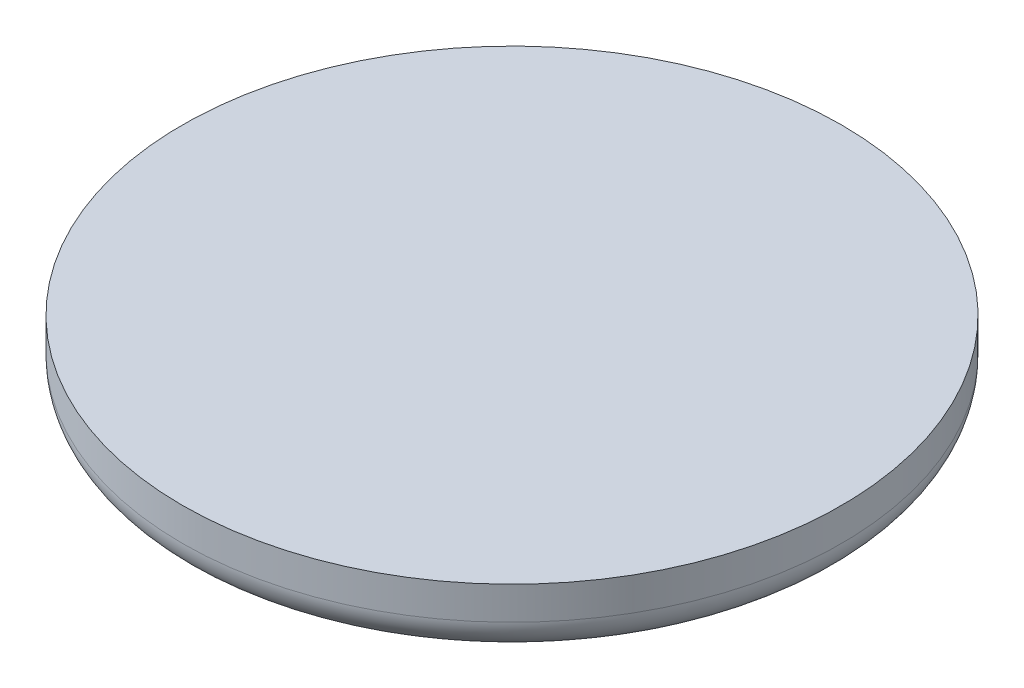
from build123d import *

# Parameters (mm, degrees)
SKETCH1_R           = 15
BOSS_EXTRUDE1_DEPTH = 3
FILLET1_R           = 1.5


with BuildPart() as part:
    # Sketch1 → Boss-Extrude1 (new body)
    with BuildSketch(Plane(origin=(0, 0, 0), x_dir=(-1, 0, 0), z_dir=(0, 1, 0))):
        with Locations(Location((0, 0, 0), (0, 0, 90))):
            Circle(SKETCH1_R)
    extrude(amount=-BOSS_EXTRUDE1_DEPTH)

    # Fillet1
    fillet1_edges = [part.edges().sort_by_distance(p)[0] for p in [
        (0, -3, -15),
    ]]
    fillet(fillet1_edges, radius=FILLET1_R)


solid = part.part
